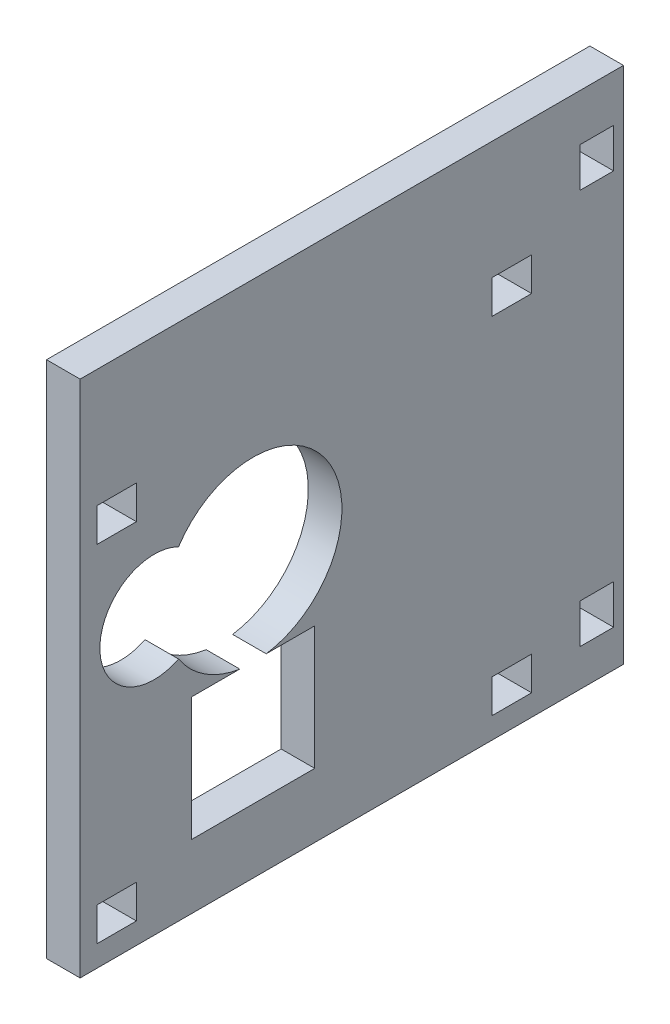
from build123d import *

# Parameters (mm, degrees)
SKETCH1_W           = 27.94
SKETCH1_H           = 27.94
SKETCH1_W_2         = 6.35
SKETCH1_H_2         = 6.35
SKETCH1_W_3         = 1.7272
SKETCH1_H_3         = 2.032
BOSS_EXTRUDE1_DEPTH = 1.7272
SKETCH4_R           = 4.572
SKETCH4_R_2         = 2.794
CUT_EXTRUDE4_DEPTH  = 1.7272
SKETCH8_W           = 1.7272
SKETCH8_H           = 2.032
CUT_EXTRUDE5_DEPTH  = 1.7272
SKETCH9_W           = 1.7272
SKETCH9_H           = 2.032
CUT_EXTRUDE6_DEPTH  = 1.7272
SKETCH10_W          = 27.94
SKETCH10_H          = 1.27
CUT_EXTRUDE7_DEPTH  = 1.7272


with BuildPart() as part:
    # Sketch1 → Boss-Extrude1 (new body)
    with BuildSketch(Plane(origin=(0, 0, 0), x_dir=(0, 0, -1), z_dir=(1, 0, 0))):
        with Locations((13.97, 13.97)):
            Rectangle(SKETCH1_W, SKETCH1_H)
        with Locations((8.89, 7.747)):
            Rectangle(SKETCH1_W_2, SKETCH1_H_2, mode=Mode.SUBTRACT)
        with Locations((26.5684, 4.191)):
            Rectangle(SKETCH1_W_3, SKETCH1_H_3, mode=Mode.SUBTRACT)
        with Locations((26.5684, 24.511)):
            Rectangle(SKETCH1_W_3, SKETCH1_H_3, mode=Mode.SUBTRACT)
    extrude(amount=BOSS_EXTRUDE1_DEPTH)

    # Sketch4 → Cut-Extrude4 (cut)
    with BuildSketch(Plane(origin=(1.7272, 0, 0), x_dir=(0, 0, -1), z_dir=(1, 0, 0))):
        with BuildLine():
            ThreePointArc((9.569657679, 10.922), (12.354864998, 12.460266118), (13.462, 15.4432))
            ThreePointArc((13.462, 15.4432), (10.193220511, 19.825528183), (5.06095, 17.941511449))
            ThreePointArc((5.06095, 17.941511449), (6.18714012, 16.911410084), (6.604, 15.4432))
            ThreePointArc((6.604, 15.4432), (6.18714012, 13.974989916), (5.06095, 12.944888551))
            ThreePointArc((5.06095, 12.944888551), (6.41914372, 11.596376213), (8.210342321, 10.922))
            Line((8.210342321, 10.922), (9.569657679, 10.922))
        make_face()
        with Locations((8.89, 15.4432)):
            Circle(SKETCH4_R)
        with Locations((3.81, 15.4432)):
            Circle(SKETCH4_R_2)
    extrude(amount=-CUT_EXTRUDE4_DEPTH, mode=Mode.SUBTRACT)

    # Sketch8 → Cut-Extrude5 (cut)
    with BuildSketch(Plane(origin=(0, 20.1422, 3.5052), x_dir=(0, -1, 0), z_dir=(1, 0, 0))):
        with Locations((-0.8636, 25.7048)):
            Rectangle(SKETCH8_W, SKETCH8_H)
        with Locations((-0.8636, 5.3848)):
            Rectangle(SKETCH8_W, SKETCH8_H)
    extrude(amount=CUT_EXTRUDE5_DEPTH, mode=Mode.SUBTRACT)

    # Sketch9 → Cut-Extrude6 (cut)
    with BuildSketch(Plane(origin=(0, 2.3622, 3.5052), x_dir=(0, -1, 0), z_dir=(1, 0, 0))):
        with Locations((-0.8636, 25.7048)):
            Rectangle(SKETCH9_W, SKETCH9_H)
        with Locations((-0.8636, 5.3848)):
            Rectangle(SKETCH9_W, SKETCH9_H)
    extrude(amount=CUT_EXTRUDE6_DEPTH, mode=Mode.SUBTRACT)

    # Sketch10 → Cut-Extrude7 (cut)
    with BuildSketch(Plane(origin=(1.7272, 0, 0), x_dir=(0, 0, -1), z_dir=(1, 0, 0))):
        with Locations((13.97, 0.635)):
            Rectangle(SKETCH10_W, SKETCH10_H)
    extrude(amount=-CUT_EXTRUDE7_DEPTH, mode=Mode.SUBTRACT)


solid = part.part
